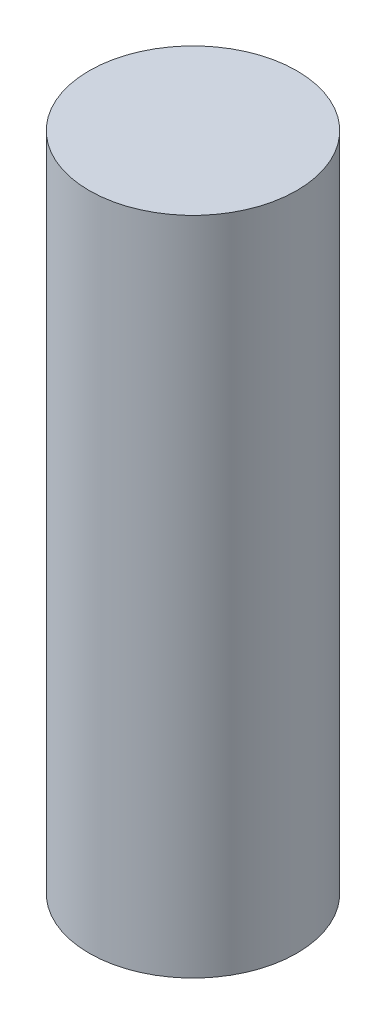
from build123d import *

# Parameters (mm, degrees)
SKETCH1_R           = 27.5
BOSS_EXTRUDE1_DEPTH = 175


with BuildPart() as part:
    # Sketch1 → Boss-Extrude1 (new body)
    with BuildSketch(Plane(origin=(0, 0, 0), x_dir=(1, 0, 0), z_dir=(0, 1, 0))):
        with Locations(Location((0, 0, 0), (0, 0, 270))):
            Circle(SKETCH1_R)
    extrude(amount=BOSS_EXTRUDE1_DEPTH)


solid = part.part
